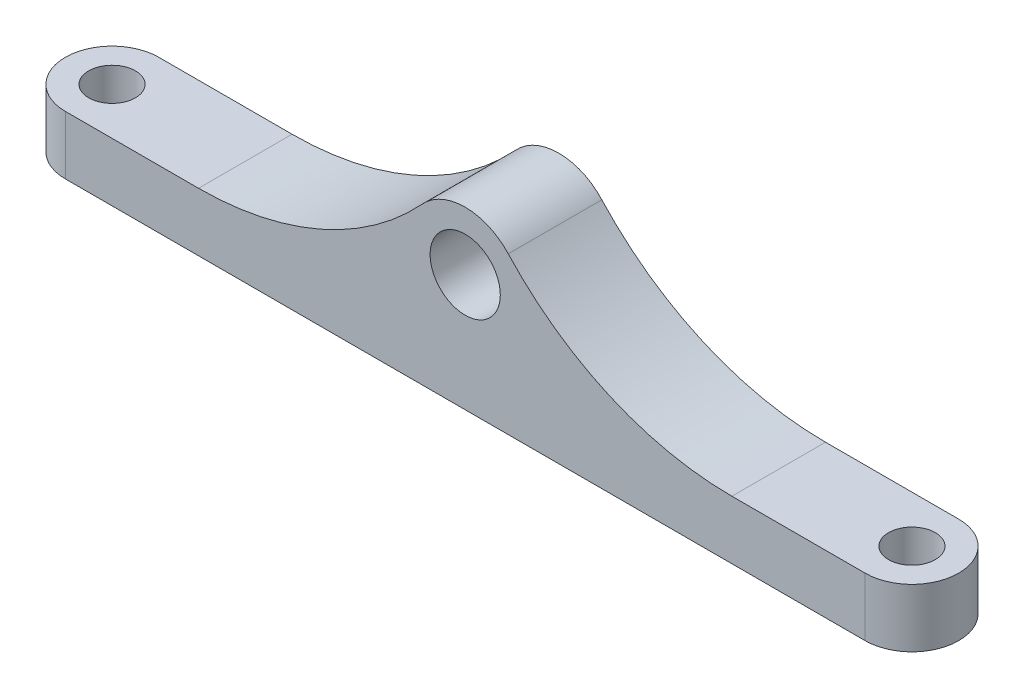
from build123d import *

# Parameters (mm, degrees)
SKETCH1_R           = 2
BOSS_EXTRUDE1_DEPTH = 5
SKETCH2_R           = 3
BOSS_EXTRUDE2_DEPTH = 8


with BuildPart() as part:
    # Sketch1 → Boss-Extrude1 (new body)
    with BuildSketch(Plane(origin=(0, 0, 0), x_dir=(1, 0, 0), z_dir=(0, 1, 0))):
        with BuildLine():
            Line((-34.19, -4), (34.19, -4))
            ThreePointArc((34.19, -4), (38.19, 0), (34.19, 4))
            Line((34.19, 4), (-34.19, 4))
            ThreePointArc((-34.19, 4), (-38.19, 0), (-34.19, -4))
        make_face()
        with Locations(Location((34.19, 0, 0), (0, 0, 270))):
            Circle(SKETCH1_R, mode=Mode.SUBTRACT)
        with Locations(Location((-34.19, 0, 0), (0, 0, 270))):
            Circle(SKETCH1_R, mode=Mode.SUBTRACT)
    extrude(amount=BOSS_EXTRUDE1_DEPTH)

    # Sketch2 → Boss-Extrude2 (add)
    with BuildSketch(Plane.XY.offset(4)):
        with BuildLine():
            ThreePointArc((-3.678488933, 13.386549744), (-12.35949887, 7.188806921), (-22.798898944, 5))
            Line((-22.798898944, 5), (6e-09, 5))
            Line((6e-09, 5), (22.798898944, 5))
            ThreePointArc((22.798898944, 5), (12.35949887, 7.188806921), (3.678488933, 13.386549744))
            ThreePointArc((3.678488933, 13.386549744), (0, 15), (-3.678488933, 13.386549744))
        make_face()
        with Locations((0, 10)):
            Circle(SKETCH2_R, mode=Mode.SUBTRACT)
    extrude(amount=-BOSS_EXTRUDE2_DEPTH)


solid = part.part
